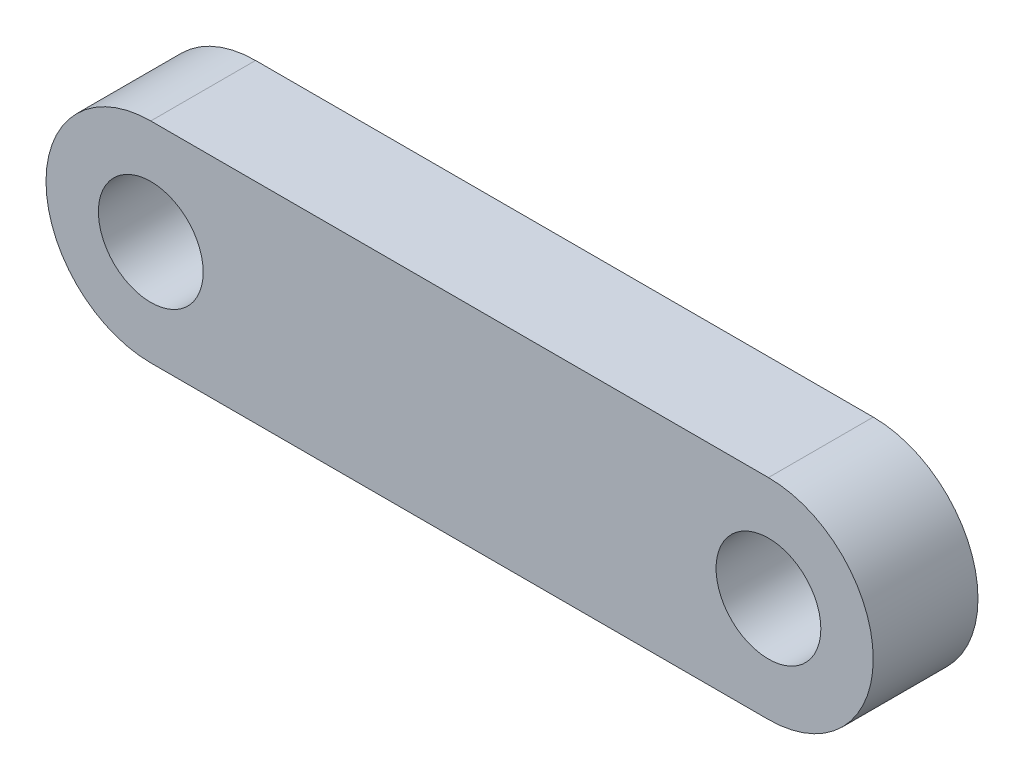
from build123d import *

# Parameters (mm, degrees)
SKETCH_1_R      = 1
EXTRUDE_1_DEPTH = 2


with BuildPart() as part:
    # 草圖1 → 填料-伸長1 (new body)
    with BuildSketch(Plane.XY):
        with BuildLine():
            Line((-5.894999992, 2.000304167), (5.895000008, 2.000304167))
            ThreePointArc((5.895000008, 2.000304167), (7.895000008, 0.000304167), (5.895000008, -1.999695833))
            Line((5.895000008, -1.999695833), (-5.894999992, -1.999695833))
            ThreePointArc((-5.894999992, -1.999695833), (-7.894999992, 0.000304167), (-5.894999992, 2.000304167))
        make_face()
        with Locations((-5.894999992, 0.000304167)):
            Circle(SKETCH_1_R, mode=Mode.SUBTRACT)
        with Locations((5.895000008, 0.000304167)):
            Circle(SKETCH_1_R, mode=Mode.SUBTRACT)
    extrude(amount=EXTRUDE_1_DEPTH)


solid = part.part
